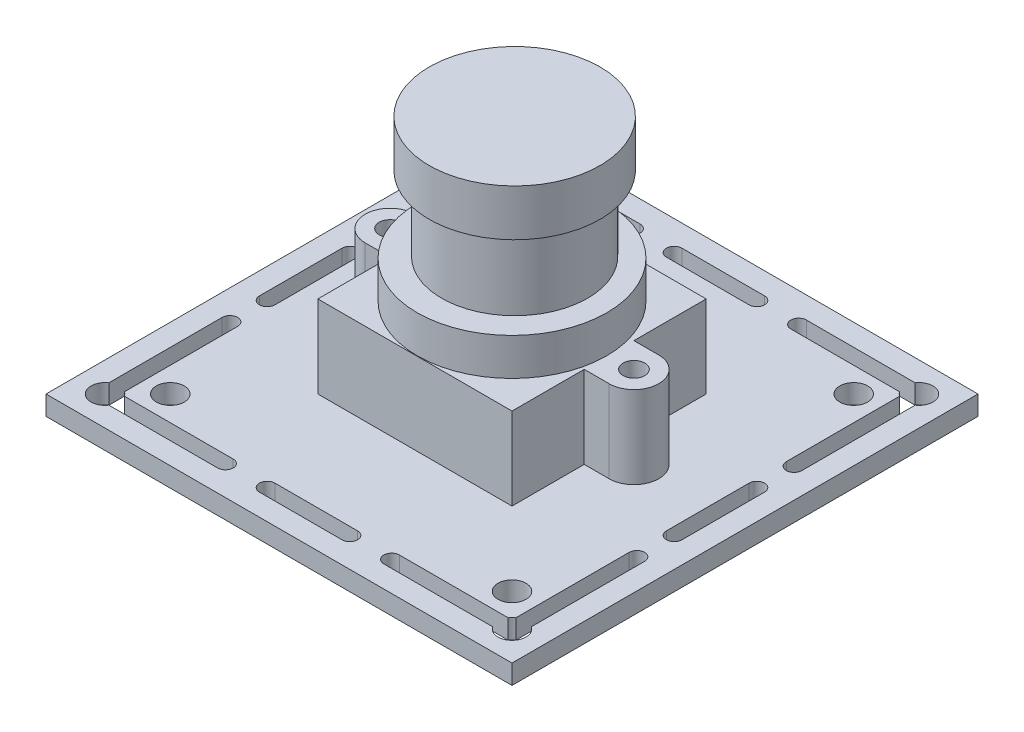
from build123d import *

# Parameters (mm, degrees)
SKETCH1_W           = 38.1
SKETCH1_H           = 38.1
BOSS_EXTRUDE1_DEPTH = 1.5875
SKETCH4_R           = 1.143
CUT_EXTRUDE2_DEPTH  = 7.874
SKETCH6_W           = 15.875
SKETCH6_H           = 15.875
BOSS_EXTRUDE2_DEPTH = 6.731
SKETCH7_R           = 0.889
BOSS_EXTRUDE3_DEPTH = 6.731
SKETCH8_R           = 7.747
BOSS_EXTRUDE4_DEPTH = 3.048
SKETCH9_R           = 5.969
BOSS_EXTRUDE5_DEPTH = 6.096
SKETCH10_R          = 6.985
BOSS_EXTRUDE6_DEPTH = 3.81
SKETCH11_W          = 9.906
SKETCH11_H          = 4.572
BOSS_EXTRUDE7_DEPTH = 8.255


with BuildPart() as part:
    # Sketch1 → Boss-Extrude1 (new body)
    with BuildSketch(Plane(origin=(0, 0, 0), x_dir=(1, 0, 0), z_dir=(0, 1, 0))):
        with Locations((-252.591789549, -315.673153846)):
            Rectangle(SKETCH1_W, SKETCH1_H)
    extrude(amount=BOSS_EXTRUDE1_DEPTH)

    # Sketch4 → Cut-Extrude2 (cut)
    with BuildSketch(Plane(origin=(0, 1.5875, 0), x_dir=(1, 0, 0), z_dir=(0, 1, 0))):
        with Locations(Location((-266.561789549, -301.703153846, 0), (0, 0, 270))):
            Circle(SKETCH4_R)
        with Locations(Location((-238.621789549, -301.703153846, 0), (0, 0, 270))):
            Circle(SKETCH4_R)
        with Locations(Location((-266.561789549, -329.643153846, 0), (0, 0, 270))):
            Circle(SKETCH4_R)
        with Locations(Location((-238.621789549, -329.643153846, 0), (0, 0, 270))):
            Circle(SKETCH4_R)
        with BuildLine():
            Line((-269.863789549, -312.294953846), (-269.863789549, -319.051353846))
            ThreePointArc((-269.863789549, -319.051353846), (-269.228789549, -319.686353846), (-268.593789549, -319.051353846))
            Line((-268.593789549, -319.051353846), (-268.593789549, -312.294953846))
            ThreePointArc((-268.593789549, -312.294953846), (-269.228789549, -311.659953846), (-269.863789549, -312.294953846))
        make_face()
        with BuildLine():
            Line((-259.385291519, -298.401153846), (-268.278408573, -298.401153846))
            ThreePointArc((-268.278408573, -298.401153846), (-270.0370126, -298.227930795), (-269.863789549, -299.986534822))
            Line((-269.863789549, -299.986534822), (-269.863789549, -309.246953846))
            ThreePointArc((-269.863789549, -309.246953846), (-269.228789549, -309.881953846), (-268.593789549, -309.246953846))
            Line((-268.593789549, -309.246953846), (-268.593789549, -299.986534822))
            ThreePointArc((-268.593789549, -299.986534822), (-268.420566498, -299.844376897), (-268.278408573, -299.671153846))
            Line((-268.278408573, -299.671153846), (-259.385291519, -299.671153846))
            ThreePointArc((-259.385291519, -299.671153846), (-258.750291519, -299.036153846), (-259.385291519, -298.401153846))
        make_face()
        with BuildLine():
            Line((-255.969989549, -298.401153846), (-249.213589549, -298.401153846))
            ThreePointArc((-249.213589549, -298.401153846), (-248.578589549, -299.036153846), (-249.213589549, -299.671153846))
            Line((-249.213589549, -299.671153846), (-255.969989549, -299.671153846))
            ThreePointArc((-255.969989549, -299.671153846), (-256.604989549, -299.036153846), (-255.969989549, -298.401153846))
        make_face()
        with BuildLine():
            Line((-236.589789549, -309.246953846), (-236.589789549, -299.986534822))
            ThreePointArc((-236.589789549, -299.986534822), (-236.7630126, -299.844376897), (-236.905170525, -299.671153846))
            Line((-236.905170525, -299.671153846), (-245.798287579, -299.671153846))
            ThreePointArc((-245.798287579, -299.671153846), (-246.433287579, -299.036153846), (-245.798287579, -298.401153846))
            Line((-245.798287579, -298.401153846), (-236.905170525, -298.401153846))
            ThreePointArc((-236.905170525, -298.401153846), (-235.146566498, -298.227930795), (-235.319789549, -299.986534822))
            Line((-235.319789549, -299.986534822), (-235.319789549, -309.246953846))
            ThreePointArc((-235.319789549, -309.246953846), (-235.954789549, -309.881953846), (-236.589789549, -309.246953846))
        make_face()
        with BuildLine():
            Line((-236.589789549, -312.294953846), (-236.589789549, -319.051353846))
            ThreePointArc((-236.589789549, -319.051353846), (-235.954789549, -319.686353846), (-235.319789549, -319.051353846))
            Line((-235.319789549, -319.051353846), (-235.319789549, -312.294953846))
            ThreePointArc((-235.319789549, -312.294953846), (-235.954789549, -311.659953846), (-236.589789549, -312.294953846))
        make_face()
        with BuildLine():
            Line((-245.798287579, -332.945153846), (-236.905170525, -332.945153846))
            ThreePointArc((-236.905170525, -332.945153846), (-235.146566498, -333.118376897), (-235.319789549, -331.35977287))
            Line((-235.319789549, -331.35977287), (-235.319789549, -322.099353846))
            ThreePointArc((-235.319789549, -322.099353846), (-235.954789549, -321.464353846), (-236.589789549, -322.099353846))
            Line((-236.589789549, -322.099353846), (-236.589789549, -331.35977287))
            ThreePointArc((-236.589789549, -331.35977287), (-236.7630126, -331.501930795), (-236.905170525, -331.675153846))
            Line((-236.905170525, -331.675153846), (-245.798287579, -331.675153846))
            ThreePointArc((-245.798287579, -331.675153846), (-246.433287579, -332.310153846), (-245.798287579, -332.945153846))
        make_face()
        with BuildLine():
            Line((-268.593789549, -322.099353846), (-268.593789549, -331.35977287))
            ThreePointArc((-268.593789549, -331.35977287), (-268.420566498, -331.501930795), (-268.278408573, -331.675153846))
            Line((-268.278408573, -331.675153846), (-259.385291519, -331.675153846))
            ThreePointArc((-259.385291519, -331.675153846), (-258.750291519, -332.310153846), (-259.385291519, -332.945153846))
            Line((-259.385291519, -332.945153846), (-268.278408573, -332.945153846))
            ThreePointArc((-268.278408573, -332.945153846), (-270.0370126, -333.118376897), (-269.863789549, -331.35977287))
            Line((-269.863789549, -331.35977287), (-269.863789549, -322.099353846))
            ThreePointArc((-269.863789549, -322.099353846), (-269.228789549, -321.464353846), (-268.593789549, -322.099353846))
        make_face()
        with BuildLine():
            Line((-255.969989549, -331.675153846), (-249.213589549, -331.675153846))
            ThreePointArc((-249.213589549, -331.675153846), (-248.578589549, -332.310153846), (-249.213589549, -332.945153846))
            Line((-249.213589549, -332.945153846), (-255.969989549, -332.945153846))
            ThreePointArc((-255.969989549, -332.945153846), (-256.604989549, -332.310153846), (-255.969989549, -331.675153846))
        make_face()
    extrude(amount=-CUT_EXTRUDE2_DEPTH, mode=Mode.SUBTRACT)

    # Sketch6 → Boss-Extrude2 (add)
    with BuildSketch(Plane(origin=(0, 1.5875, 0), x_dir=(1, 0, 0), z_dir=(0, 1, 0))):
        with Locations((-252.591789549, -315.673153846)):
            Rectangle(SKETCH6_W, SKETCH6_H)
    extrude(amount=BOSS_EXTRUDE2_DEPTH)

    # Sketch7 → Boss-Extrude3 (add)
    # profile 1 of 2: a face of its own
    with BuildSketch(Plane(origin=(0, 1.5875, 0), x_dir=(1, 0, 0), z_dir=(0, 1, 0))):
        with BuildLine():
            Line((-242.622289549, -313.641153846), (-244.654289549, -313.641153846))
            Line((-244.654289549, -313.641153846), (-244.654289549, -317.705153846))
            Line((-244.654289549, -317.705153846), (-242.622289549, -317.705153846))
            ThreePointArc((-242.622289549, -317.705153846), (-240.590289549, -315.673153846), (-242.622289549, -313.641153846))
        make_face()
        with Locations(Location((-242.622289549, -315.673153846, 0), (0, 0, 270))):
            Circle(SKETCH7_R, mode=Mode.SUBTRACT)
    # profile 2 of 2: a face of its own
    with BuildSketch(Plane(origin=(0, 1.5875, 0), x_dir=(1, 0, 0), z_dir=(0, 1, 0))):
        with BuildLine():
            Line((-262.561289549, -317.705153846), (-260.529289549, -317.705153846))
            Line((-260.529289549, -317.705153846), (-260.529289549, -313.641153846))
            Line((-260.529289549, -313.641153846), (-262.561289549, -313.641153846))
            ThreePointArc((-262.561289549, -313.641153846), (-264.593289549, -315.673153846), (-262.561289549, -317.705153846))
        make_face()
        with Locations(Location((-262.561289549, -315.673153846, 0), (0, 0, 90))):
            Circle(SKETCH7_R, mode=Mode.SUBTRACT)
    extrude(amount=BOSS_EXTRUDE3_DEPTH)

    # Sketch8 → Boss-Extrude4 (add)
    with BuildSketch(Plane(origin=(0, 8.3185, 0), x_dir=(1, 0, 0), z_dir=(0, 1, 0))):
        with Locations(Location((-252.436354268, -315.828589127, 0), (0, 0, 90))):
            Circle(SKETCH8_R)
    extrude(amount=BOSS_EXTRUDE4_DEPTH)

    # Sketch9 → Boss-Extrude5 (add)
    with BuildSketch(Plane(origin=(0, 11.3665, 0), x_dir=(1, 0, 0), z_dir=(0, 1, 0))):
        with Locations(Location((-252.465375739, -315.583143422, 0), (0, 0, 90))):
            Circle(SKETCH9_R)
    extrude(amount=BOSS_EXTRUDE5_DEPTH)

    # Sketch10 → Boss-Extrude6 (add)
    with BuildSketch(Plane(origin=(0, 17.4625, 0), x_dir=(1, 0, 0), z_dir=(0, 1, 0))):
        with Locations(Location((-252.465375739, -315.583143422, 0), (0, 0, 90))):
            Circle(SKETCH10_R)
    extrude(amount=BOSS_EXTRUDE6_DEPTH)

    # Sketch11 → Boss-Extrude7 (add)
    with BuildSketch(Plane.XZ):
        with Locations((-256.737392156, 301.957153846)):
            Rectangle(SKETCH11_W, SKETCH11_H)
    extrude(amount=BOSS_EXTRUDE7_DEPTH)


solid = part.part
